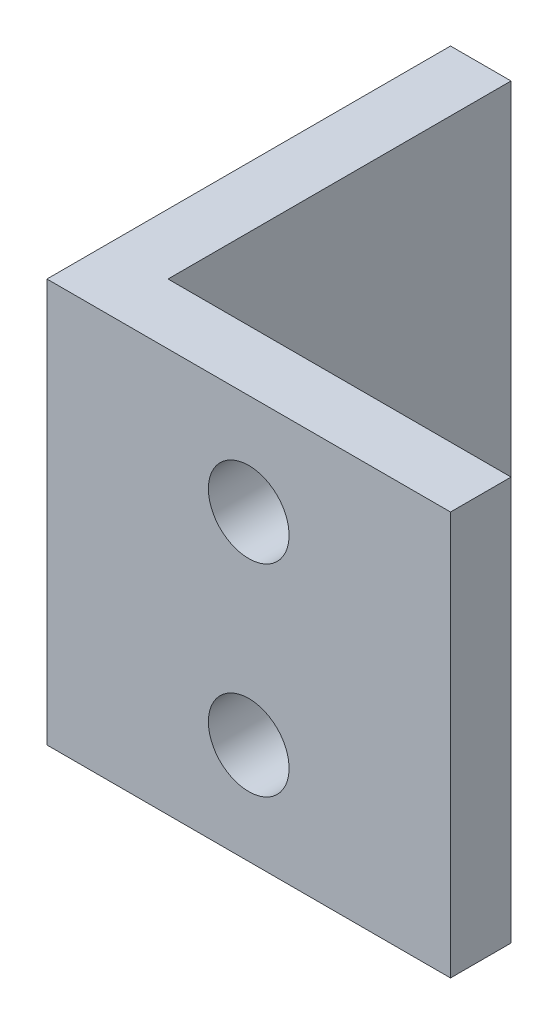
from build123d import *

# Parameters (mm, degrees)
SKETCH_1_W                  = 20
SKETCH_1_H                  = 20
EXTRUDE_1_DEPTH             = 20
SKETCH_2_W                  = 17
SKETCH_2_H                  = 17
CUT_EXTRUDE_1_DEPTH         = 66.429351212
HOLE_WIZARD_4_2_4_2_1_D     = 4.2
HOLE_WIZARD_4_2_4_2_1_DEPTH = 20
HOLE_WIZARD_4_0_4_1_D       = 4


with BuildPart() as part:
    # 草图1 → 凸台-拉伸1 (new body)
    with BuildSketch(Plane(origin=(0, 160, 0), x_dir=(1, 0, 0), z_dir=(0, 1, 0))):
        with Locations((49, -10)):
            Rectangle(SKETCH_1_W, SKETCH_1_H)
    extrude(amount=-EXTRUDE_1_DEPTH)

    # 草图2 → 切除-拉伸1 (cut, through all)
    with BuildSketch(Plane.XZ.offset(-140)):
        with Locations((50.5, 8.5)):
            Rectangle(SKETCH_2_W, SKETCH_2_H)
    extrude(amount=-CUT_EXTRUDE_1_DEPTH, mode=Mode.SUBTRACT)

    # Ø4.2 (4.2) 直径孔1
    with Locations(Plane.ZY.offset(-39)):
        with Locations((10, 150)):
            Hole(HOLE_WIZARD_4_2_4_2_1_D / 2, depth=HOLE_WIZARD_4_2_4_2_1_DEPTH)

    # Ø4.0 (4) 直径孔1 (through all)
    with Locations(Plane(origin=(0, 0, 17), x_dir=(-1, 0, 0), z_dir=(0, 0, -1))):
        with Locations((-49, 145), (-49, 155)):
            Hole(HOLE_WIZARD_4_0_4_1_D / 2)


solid = part.part
